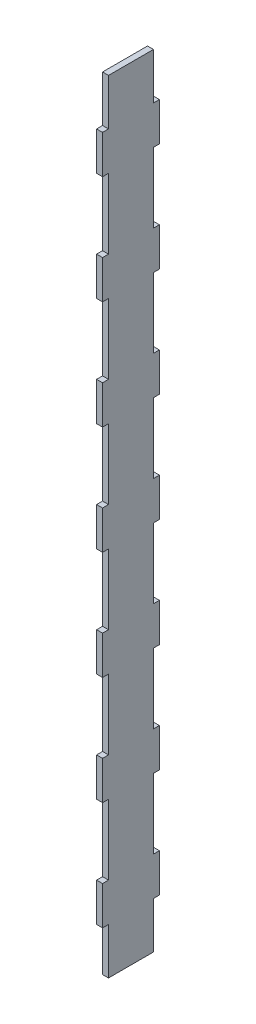
from build123d import *

# Parameters (mm, degrees)
BOSS_EXTRU_1_DEPTH        = 27.175
BOSS_EXTRU_1_DEPTH_BACK   = 3.175
BOSS_EXTRU_1_2_DEPTH      = 27.175
BOSS_EXTRU_1_2_DEPTH_BACK = 3.175
BOSS_EXTRU_1_3_DEPTH      = 27.175
BOSS_EXTRU_1_3_DEPTH_BACK = 3.175
BOSS_EXTRU_1_4_DEPTH      = 27.175
BOSS_EXTRU_1_4_DEPTH_BACK = 3.175
BOSS_EXTRU_1_5_DEPTH      = 27.175
BOSS_EXTRU_1_5_DEPTH_BACK = 3.175
BOSS_EXTRU_1_6_DEPTH      = 27.175
BOSS_EXTRU_1_6_DEPTH_BACK = 3.175
BOSS_EXTRU_1_7_DEPTH      = 27.175
BOSS_EXTRU_1_7_DEPTH_BACK = 3.175
BOSS_EXTRU_2_DEPTH        = 198.346
BOSS_EXTRU_2_DEPTH_BACK   = 218.854
ESQUISSE2_W               = 3.175
ESQUISSE2_H               = 24


with BuildPart() as part:
    # Esquisse1 → Boss.-Extru.1 (new, two sides: drawn at the far end of the back side and taken through both)
    with BuildSketch(Plane.XY.offset(-BOSS_EXTRU_1_DEPTH_BACK)):
        Polygon((-43, 163.6), (-43, 163.346), (-39.825, 163.346), (-39.825, 163.6), (-39.825, 183.6), (-39.825, 183.854), (-43, 183.854), (-43, 183.6), align=None)
    extrude(amount=BOSS_EXTRU_1_DEPTH + BOSS_EXTRU_1_DEPTH_BACK)



with BuildPart() as body_2:
    # Esquisse1 → Boss.-Extru.1 2 (new, two sides: drawn at the far end of the back side and taken through both)
    with BuildSketch(Plane.XY.offset(-BOSS_EXTRU_1_2_DEPTH_BACK)):
        Polygon((-43, 125.733333333), (-43, 125.987333333), (-39.825, 125.987333333), (-39.825, 125.733333333), (-39.825, 105.733333333), (-39.825, 105.479333333), (-43, 105.479333333), (-43, 105.733333333), align=None)
    extrude(amount=BOSS_EXTRU_1_2_DEPTH + BOSS_EXTRU_1_2_DEPTH_BACK)


with BuildPart() as body_3:
    # Esquisse1 → Boss.-Extru.1 3 (new, two sides: drawn at the far end of the back side and taken through both)
    with BuildSketch(Plane.XY.offset(-BOSS_EXTRU_1_3_DEPTH_BACK)):
        Polygon((-43, 67.866666667), (-43, 68.120666667), (-39.825, 68.120666667), (-39.825, 67.866666667), (-39.825, 47.866666667), (-39.825, 47.612666667), (-43, 47.612666667), (-43, 47.866666667), align=None)
    extrude(amount=BOSS_EXTRU_1_3_DEPTH + BOSS_EXTRU_1_3_DEPTH_BACK)


with BuildPart() as body_4:
    # Esquisse1 → Boss.-Extru.1 4 (new, two sides: drawn at the far end of the back side and taken through both)
    with BuildSketch(Plane.XY.offset(-BOSS_EXTRU_1_4_DEPTH_BACK)):
        Polygon((-43, 10), (-43, 10.254), (-39.825, 10.254), (-39.825, 10), (-39.825, -10), (-39.825, -10.254), (-43, -10.254), (-43, -10), align=None)
    extrude(amount=BOSS_EXTRU_1_4_DEPTH + BOSS_EXTRU_1_4_DEPTH_BACK)


with BuildPart() as body_5:
    # Esquisse1 → Boss.-Extru.1 5 (new, two sides: drawn at the far end of the back side and taken through both)
    with BuildSketch(Plane.XY.offset(-BOSS_EXTRU_1_5_DEPTH_BACK)):
        Polygon((-43, -163.6), (-43, -183.6), (-43, -183.854), (-39.825, -183.854), (-39.825, -183.6), (-39.825, -163.6), (-39.825, -163.346), (-43, -163.346), align=None)
    extrude(amount=BOSS_EXTRU_1_5_DEPTH + BOSS_EXTRU_1_5_DEPTH_BACK)


with BuildPart() as body_6:
    # Esquisse1 → Boss.-Extru.1 6 (new, two sides: drawn at the far end of the back side and taken through both)
    with BuildSketch(Plane.XY.offset(-BOSS_EXTRU_1_6_DEPTH_BACK)):
        Polygon((-43, -105.733333333), (-43, -125.733333333), (-43, -125.987333333), (-39.825, -125.987333333), (-39.825, -125.733333333), (-39.825, -105.733333333), (-39.825, -105.479333333), (-43, -105.479333333), align=None)
    extrude(amount=BOSS_EXTRU_1_6_DEPTH + BOSS_EXTRU_1_6_DEPTH_BACK)


with BuildPart() as body_7:
    # Esquisse1 → Boss.-Extru.1 7 (new, two sides: drawn at the far end of the back side and taken through both)
    with BuildSketch(Plane.XY.offset(-BOSS_EXTRU_1_7_DEPTH_BACK)):
        Polygon((-43, -47.866666667), (-43, -67.866666667), (-43, -68.120666667), (-39.825, -68.120666667), (-39.825, -67.866666667), (-39.825, -47.866666667), (-39.825, -47.612666667), (-43, -47.612666667), align=None)
    extrude(amount=BOSS_EXTRU_1_7_DEPTH + BOSS_EXTRU_1_7_DEPTH_BACK)


with BuildPart() as part_1:
    add(part.part)

    add(body_2.part)  # Boss.-Extru.2 merges body 2

    add(body_3.part)  # Boss.-Extru.2 merges body 3

    add(body_4.part)  # Boss.-Extru.2 merges body 4

    add(body_5.part)  # Boss.-Extru.2 merges body 5

    add(body_6.part)  # Boss.-Extru.2 merges body 6

    add(body_7.part)  # Boss.-Extru.2 merges body 7
    # Esquisse2 → Boss.-Extru.2 (add, two sides: drawn at the far end of the back side and taken through both)
    with BuildSketch(Plane.XZ.offset(10.254).offset(-BOSS_EXTRU_2_DEPTH_BACK)):
        with Locations((-41.4125, 12)):
            Rectangle(ESQUISSE2_W, ESQUISSE2_H)
    extrude(amount=BOSS_EXTRU_2_DEPTH + BOSS_EXTRU_2_DEPTH_BACK)


solid = part_1.part
